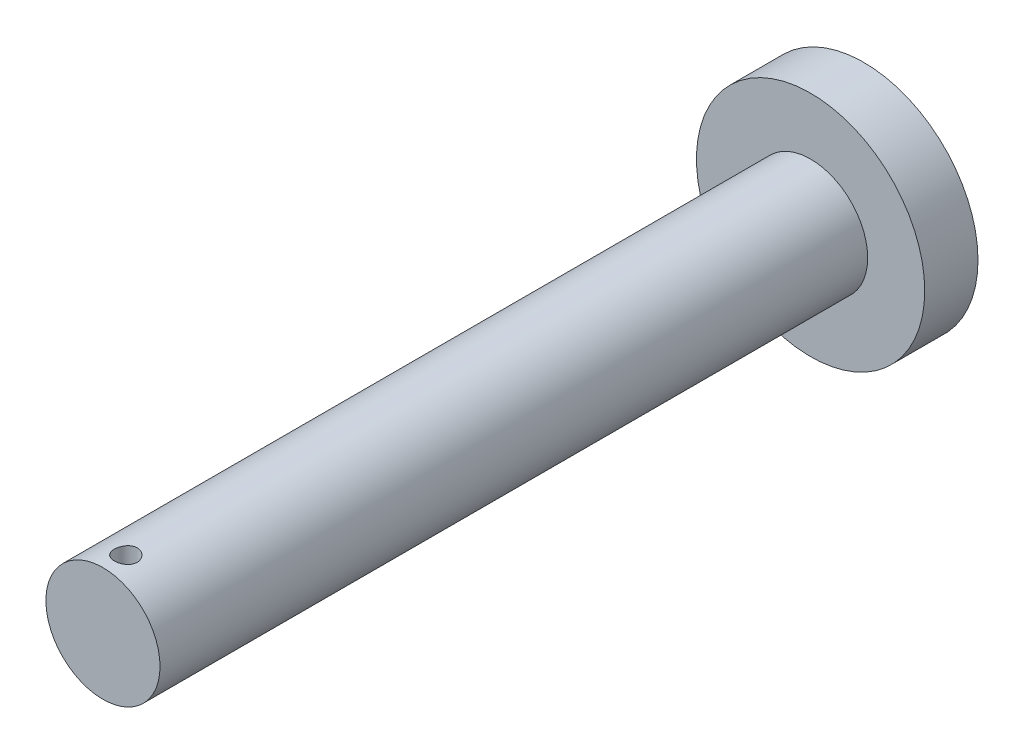
from build123d import *

# Parameters (mm, degrees)
SKETCH1_R           = 30
BOSS_EXTRUDE1_DEPTH = 14
SKETCH2_R           = 15
BOSS_EXTRUDE2_DEPTH = 186
SKETCH3_R           = 3
CUT_EXTRUDE1_DEPTH  = 93


with BuildPart() as part:
    # Sketch1 → Boss-Extrude1 (new body)
    with BuildSketch(Plane.XY):
        Circle(SKETCH1_R)
    extrude(amount=BOSS_EXTRUDE1_DEPTH)

    # Sketch2 → Boss-Extrude2 (add)
    with BuildSketch(Plane.XY.offset(14)):
        with Locations(Location((0, 0, 0), (0, 0, 180))):
            Circle(SKETCH2_R)
    extrude(amount=BOSS_EXTRUDE2_DEPTH)

    # Sketch3 → Cut-Extrude1 (cut, symmetric)
    with BuildSketch(Plane(origin=(0, 0, 0), x_dir=(1, 0, 0), z_dir=(0, 1, 0))):
        with Locations(Location((0, -194, 0), (0, 0, 270))):
            Circle(SKETCH3_R)
    extrude(amount=CUT_EXTRUDE1_DEPTH, both=True, mode=Mode.SUBTRACT)


solid = part.part
